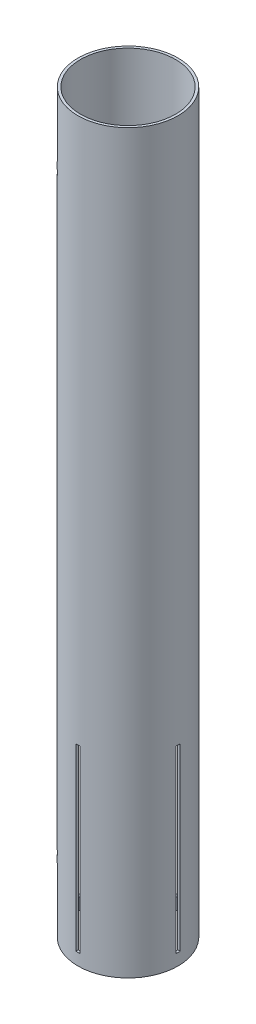
from build123d import *

# Parameters (mm, degrees)
SKETCH1_R                       = 33.9725
SKETCH1_R_2                     = 32.258
BULK_DEPTH                      = 500
SKETCH2_R                       = 1.75
LAUNCH_LUG_SCREW_HOLES_DEPTH    = 503.302957897
SKETCH3_W                       = 3
SKETCH3_H                       = 122
THRU_WALL_FIN_CUTS_DEPTH        = 503.30295801
THRU_WALL_FIN_CUT_PATTERN_COUNT = 2
THRU_WALL_FIN_CUT_PATTERN_ANGLE = 90


with BuildPart() as part:
    # Sketch1 → BULK (new body)
    with BuildSketch(Plane(origin=(0, 0, 0), x_dir=(1, 0, 0), z_dir=(0, 1, 0))):
        Circle(SKETCH1_R)
        Circle(SKETCH1_R_2, mode=Mode.SUBTRACT)
    extrude(amount=BULK_DEPTH)

    # Sketch2 → LAUNCH LUG SCREW HOLES (cut, through all)
    with BuildSketch(Plane(origin=(0, 0, 0), x_dir=(0.7071067811865477, 0, 0.7071067811865475), z_dir=(-0.7071067811865475, 0, 0.7071067811865477))):
        with Locations((0, 50)):
            Circle(SKETCH2_R)
        with Locations((0, 450)):
            Circle(SKETCH2_R)
    extrude(amount=LAUNCH_LUG_SCREW_HOLES_DEPTH, mode=Mode.SUBTRACT)

    # Sketch3 → THRU WALL FIN CUTS (cut, symmetric)
    with BuildSketch(Plane.XY):
        with Locations((0, 69)):
            Rectangle(SKETCH3_W, SKETCH3_H)
    thru_wall_fin_cuts = extrude(amount=THRU_WALL_FIN_CUTS_DEPTH, both=True, mode=Mode.SUBTRACT)

    # THRU WALL FIN CUT PATTERN: THRU WALL FIN CUTS ×2 about axis
    thru_wall_fin_cut_pattern_axis = Axis((0, -25, 0), (0, 1, 0))
    for i in range(1, THRU_WALL_FIN_CUT_PATTERN_COUNT):
        add(thru_wall_fin_cuts.rotate(thru_wall_fin_cut_pattern_axis, i * THRU_WALL_FIN_CUT_PATTERN_ANGLE / (THRU_WALL_FIN_CUT_PATTERN_COUNT - 1)), mode=Mode.SUBTRACT)


solid = part.part
